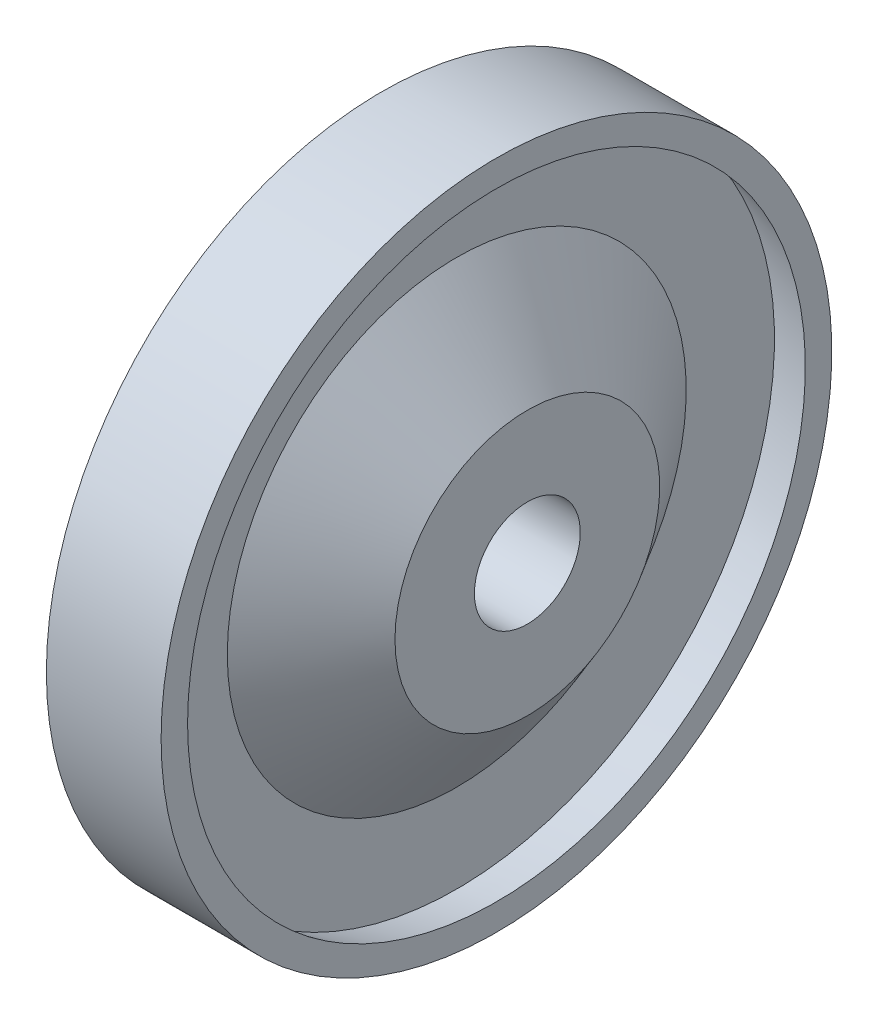
from build123d import *


with BuildPart() as part:
    # Sketch1 → Revolve1 (revolve)
    with BuildSketch(Plane.XY, mode=Mode.PRIVATE) as revolve1_sk:
        Polygon((13, 76), (13, 70), (4, 72), (4, 52), (20, 30), (20, 12), (-20, 12), (-20, 30), (-4, 52), (-4, 72), (-13, 70), (-13, 76), align=None)
    revolve(revolve1_sk.sketch.rotate(Axis((0, 0, 0), (1, 0, 0)), 90), axis=Axis((0, 0, 0), (1, 0, 0)))


solid = part.part
